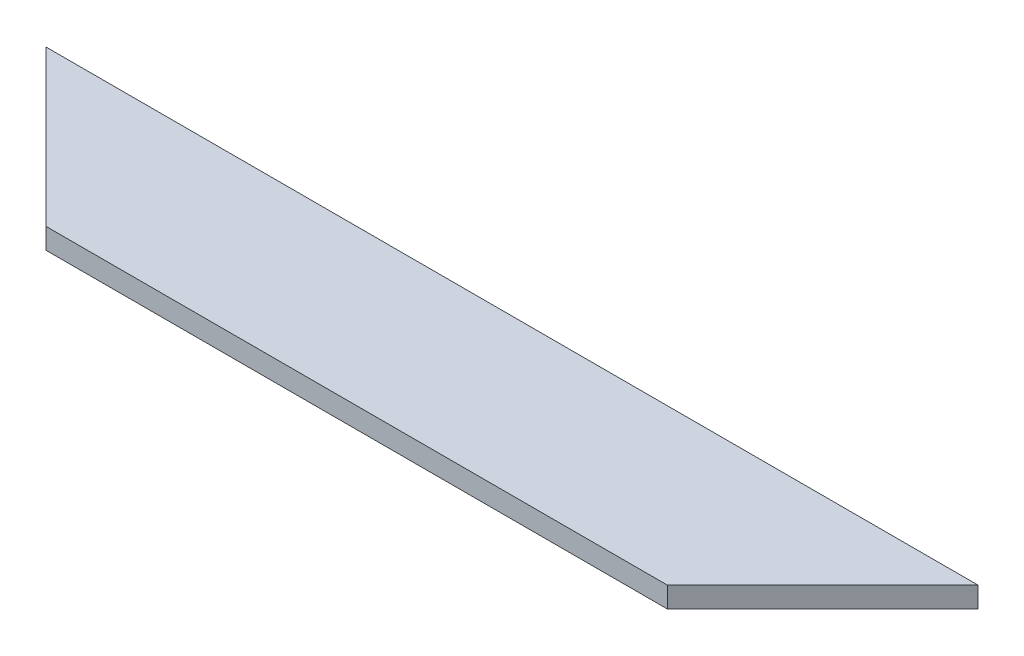
from build123d import *

# Parameters (mm, degrees)
EXTRUDE_1_DEPTH = 2


with BuildPart() as part:
    # Эскиз1 → Бобышка-Вытянуть1 (new body)
    with BuildSketch(Plane(origin=(0, 0, 0), x_dir=(1, 0, 0), z_dir=(0, 1, 0))):
        Polygon((0, 15), (15, 0), (75, 0), (90, 15), align=None)
    extrude(amount=EXTRUDE_1_DEPTH)


solid = part.part
